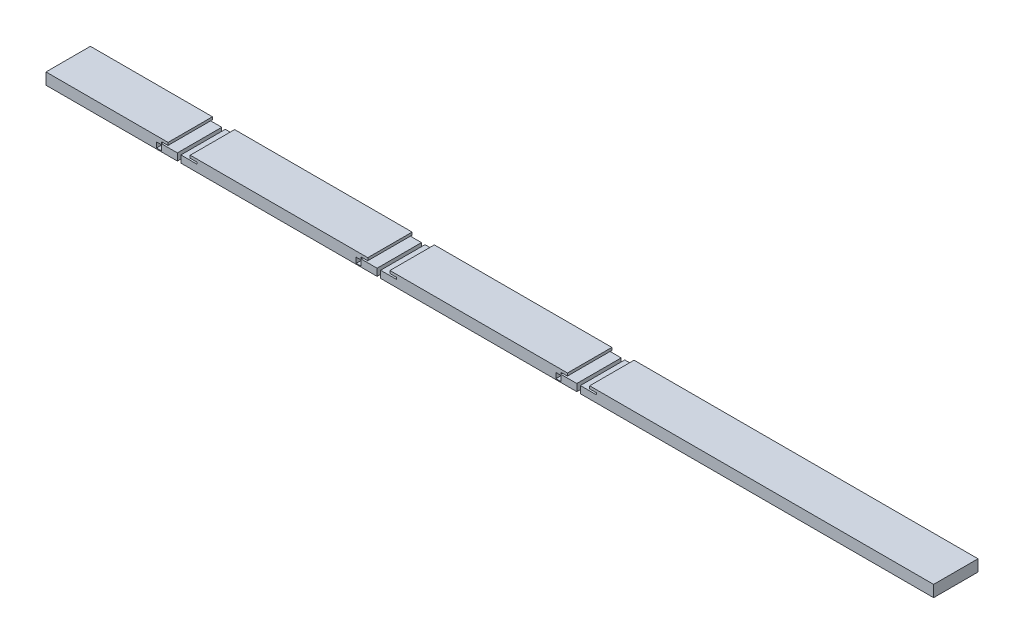
from build123d import *

# Parameters (mm, degrees)
SKETCH1_W             = 200
SKETCH1_H             = 10
BOSS_EXTRUDE1_DEPTH   = 2.6
SKETCH3_W             = 0.8
SKETCH3_H             = 10
CUT_EXTRUDE1_DEPTH    = 2
SKETCH4_W             = 5
SKETCH4_H             = 10
CUT_EXTRUDE2_DEPTH    = 0.6
SKETCH5_W             = 5
SKETCH5_H             = 10
BOSS_EXTRUDE2_DEPTH   = 0.6
BOSS_EXTRUDE2_2_DEPTH = 0.6
BOSS_EXTRUDE2_3_DEPTH = 0.6
SKETCH6_W             = 3.6
SKETCH6_H             = 10
CUT_EXTRUDE3_DEPTH    = 0.4
SKETCH11_W            = 1.1
SKETCH11_H            = 1.2
CUT_EXTRUDE4_DEPTH    = 5
SKETCH12_W            = 5
SKETCH12_H            = 10
CUT_EXTRUDE6_DEPTH    = 0.6


with BuildPart() as part:
    # Sketch1 → Boss-Extrude1 (new body)
    with BuildSketch(Plane(origin=(0, 0, 0), x_dir=(1, 0, 0), z_dir=(0, 1, 0))):
        with Locations((78.695652174, -3.217391304)):
            Rectangle(SKETCH1_W, SKETCH1_H)
    extrude(amount=BOSS_EXTRUDE1_DEPTH)

    # Sketch3 → Cut-Extrude1 (cut)
    with BuildSketch(Plane.XZ):
        with Locations((8.695652174, 3.217391304)):
            Rectangle(SKETCH3_W, SKETCH3_H)
        with Locations((53.695652174, 3.217391304)):
            Rectangle(SKETCH3_W, SKETCH3_H)
        with Locations((98.695652174, 3.217391304)):
            Rectangle(SKETCH3_W, SKETCH3_H)
    extrude(amount=-CUT_EXTRUDE1_DEPTH, mode=Mode.SUBTRACT)

    # Sketch4 → Cut-Extrude2 (cut)
    with BuildSketch(Plane(origin=(0, 2.6, 0), x_dir=(1, 0, 0), z_dir=(0, 1, 0))):
        with Locations((98.695652174, -3.217391304)):
            Rectangle(SKETCH4_W, SKETCH4_H)
        with Locations((53.695652174, -3.217391304)):
            Rectangle(SKETCH4_W, SKETCH4_H)
        with Locations((8.695652174, -3.217391304)):
            Rectangle(SKETCH4_W, SKETCH4_H)
    extrude(amount=-CUT_EXTRUDE2_DEPTH, mode=Mode.SUBTRACT)


with BuildPart() as cut_extrude2_piece_1:
    # of the separate pieces the step leaves, piece 1, a body of its own (cut_extrude2_pieces)
    add(part.part.solids().sort_by_distance((101.195652174, 2.6, 8.217391304))[0])


with BuildPart() as cut_extrude2_piece_2:
    # of the separate pieces the step leaves, piece 2, a body of its own (cut_extrude2_pieces)
    add(part.part.solids().sort_by_distance((56.195652174, 2.6, 8.217391304))[0])


with BuildPart() as cut_extrude2_piece_3:
    # of the separate pieces the step leaves, piece 3, a body of its own (cut_extrude2_pieces)
    add(part.part.solids().sort_by_distance((9.095652174, 0, 8.217391304))[0])


with BuildPart() as cut_extrude2_piece_4:
    # of the separate pieces the step leaves, piece 4, a body of its own (cut_extrude2_pieces)
    add(part.part.solids().sort_by_distance((-21.304347826, 0, 8.217391304))[0])


with BuildPart() as body_5:
    # Sketch5 → Boss-Extrude2 (new body)
    with BuildSketch(Plane(origin=(0, 2, 0), x_dir=(1, 0, 0), z_dir=(0, 1, 0))):
        with Locations((98.695652174, -3.217391304)):
            Rectangle(SKETCH5_W, SKETCH5_H)
    extrude(amount=BOSS_EXTRUDE2_DEPTH)


with BuildPart() as body_6:
    # Sketch5 → Boss-Extrude2 2 (new body)
    with BuildSketch(Plane(origin=(0, 2, 0), x_dir=(1, 0, 0), z_dir=(0, 1, 0))):
        with Locations((53.695652174, -3.217391304)):
            Rectangle(SKETCH5_W, SKETCH5_H)
    extrude(amount=BOSS_EXTRUDE2_2_DEPTH)


with BuildPart() as body_7:
    # Sketch5 → Boss-Extrude2 3 (new body)
    with BuildSketch(Plane(origin=(0, 2, 0), x_dir=(1, 0, 0), z_dir=(0, 1, 0))):
        with Locations((8.695652174, -3.217391304)):
            Rectangle(SKETCH5_W, SKETCH5_H)
    extrude(amount=BOSS_EXTRUDE2_3_DEPTH)


with BuildPart() as cut_extrude3_tool:
    # Sketch6 → Cut-Extrude3 (new body)
    with BuildSketch(Plane(origin=(0, 2, 0), x_dir=(1, 0, 0), z_dir=(0, 1, 0))):
        with Locations((10.895652174, -3.217391304)):
            Rectangle(SKETCH6_W, SKETCH6_H)
        with Locations((55.895652174, -3.217391304)):
            Rectangle(SKETCH6_W, SKETCH6_H)
        with Locations((51.495652174, -3.217391304)):
            Rectangle(SKETCH6_W, SKETCH6_H)
        with Locations((96.495652174, -3.217391304)):
            Rectangle(SKETCH6_W, SKETCH6_H)
        with Locations((100.895652174, -3.217391304)):
            Rectangle(SKETCH6_W, SKETCH6_H)
        with Locations((6.495652174, -3.217391304)):
            Rectangle(SKETCH6_W, SKETCH6_H)
    extrude(amount=-CUT_EXTRUDE3_DEPTH)


with BuildPart() as cut_extrude2_piece_1_1:
    add(cut_extrude2_piece_1.part)

    # Cut-Extrude3: cut by cut_extrude3_tool
    add(cut_extrude3_tool.part, mode=Mode.SUBTRACT)


with BuildPart() as cut_extrude2_piece_2_1:
    add(cut_extrude2_piece_2.part)

    # Cut-Extrude3: cut by cut_extrude3_tool
    add(cut_extrude3_tool.part, mode=Mode.SUBTRACT)


with BuildPart() as cut_extrude2_piece_3_1:
    add(cut_extrude2_piece_3.part)

    # Cut-Extrude3: cut by cut_extrude3_tool
    add(cut_extrude3_tool.part, mode=Mode.SUBTRACT)


with BuildPart() as cut_extrude2_piece_4_1:
    add(cut_extrude2_piece_4.part)

    # Cut-Extrude3: cut by cut_extrude3_tool
    add(cut_extrude3_tool.part, mode=Mode.SUBTRACT)


with BuildPart() as cut_extrude4_tool:
    # Sketch11 → Cut-Extrude4 (new body)
    with BuildSketch(Plane.XY.offset(8.217391304)):
        with Locations((4.145652174, 0.8)):
            Rectangle(SKETCH11_W, SKETCH11_H)
        with Locations((49.145652174, 0.8)):
            Rectangle(SKETCH11_W, SKETCH11_H)
        with Locations((94.145652174, 0.8)):
            Rectangle(SKETCH11_W, SKETCH11_H)
    extrude(amount=-CUT_EXTRUDE4_DEPTH)


with BuildPart() as cut_extrude2_piece_2_2:
    add(cut_extrude2_piece_2_1.part)

    # Cut-Extrude4: cut by cut_extrude4_tool
    add(cut_extrude4_tool.part, mode=Mode.SUBTRACT)


with BuildPart() as cut_extrude2_piece_3_2:
    add(cut_extrude2_piece_3_1.part)

    # Cut-Extrude4: cut by cut_extrude4_tool
    add(cut_extrude4_tool.part, mode=Mode.SUBTRACT)


with BuildPart() as cut_extrude2_piece_4_2:
    add(cut_extrude2_piece_4_1.part)

    # Cut-Extrude4: cut by cut_extrude4_tool
    add(cut_extrude4_tool.part, mode=Mode.SUBTRACT)


with BuildPart() as cut_extrude6_tool:
    # Sketch12 → Cut-Extrude6 (new body)
    with BuildSketch(Plane(origin=(0, 2.6, 0), x_dir=(1, 0, 0), z_dir=(0, 1, 0))):
        with Locations((8.695652174, -3.217391304)):
            Rectangle(SKETCH12_W, SKETCH12_H)
        with Locations((53.695652174, -3.217391304)):
            Rectangle(SKETCH12_W, SKETCH12_H)
        with Locations((98.695652174, -3.217391304)):
            Rectangle(SKETCH12_W, SKETCH12_H)
    extrude(amount=-CUT_EXTRUDE6_DEPTH)


with BuildPart() as body_5_1:
    add(body_5.part)

    # Cut-Extrude6: cut by cut_extrude6_tool
    add(cut_extrude6_tool.part, mode=Mode.SUBTRACT)


with BuildPart() as body_6_1:
    add(body_6.part)

    # Cut-Extrude6: cut by cut_extrude6_tool
    add(cut_extrude6_tool.part, mode=Mode.SUBTRACT)


with BuildPart() as body_7_1:
    add(body_7.part)

    # Cut-Extrude6: cut by cut_extrude6_tool
    add(cut_extrude6_tool.part, mode=Mode.SUBTRACT)


solid = Compound([cut_extrude2_piece_1_1.part, cut_extrude2_piece_2_2.part, cut_extrude2_piece_3_2.part, cut_extrude2_piece_4_2.part])
